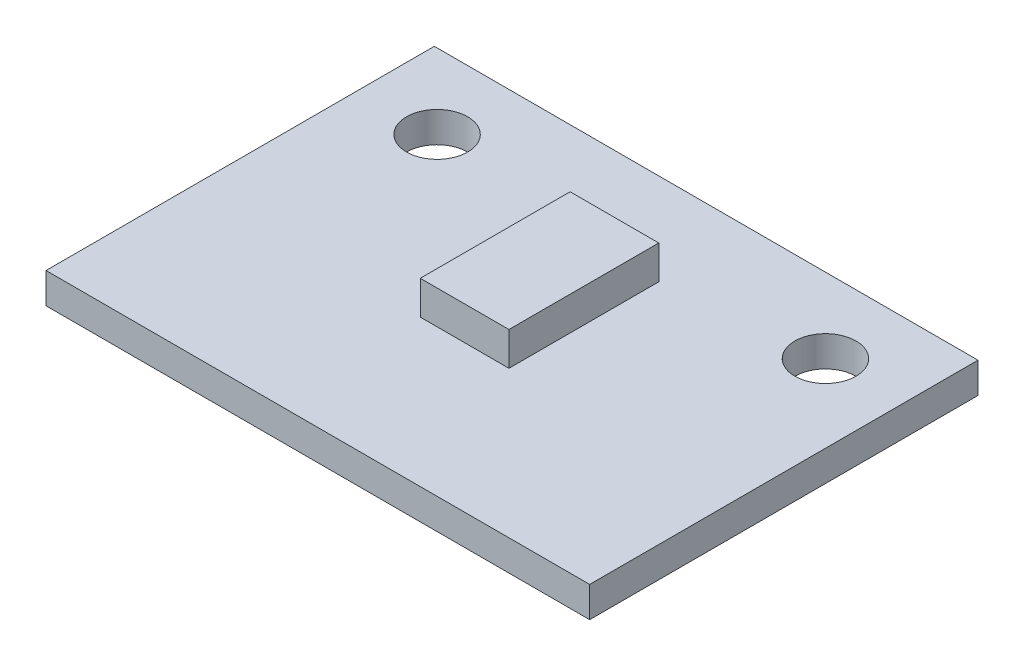
from build123d import *

# Parameters (mm, degrees)
SKETCH_1_W      = 17.78
SKETCH_1_H      = 12.7
SKETCH_1_R      = 1
SKETCH_1_W_2    = 2.9
SKETCH_1_H_2    = 4.9
EXTRUDE_1_DEPTH = 1
SKETCH_1_3_W    = 2.9
SKETCH_1_3_H    = 4.9
EXTRUDE_2_DEPTH = 2.1


with BuildPart() as part:
    # 草图1 → 凸台-拉伸1 (new body)
    # profile 1 of 2: a face of its own
    with BuildSketch(Plane(origin=(0, 0, 0), x_dir=(1, 0, 0), z_dir=(0, 1, 0))):
        Rectangle(SKETCH_1_W, SKETCH_1_H)
        with Locations(Location((6.35, 3.9, 0), (0, 0, 270))):
            Circle(SKETCH_1_R, mode=Mode.SUBTRACT)
        with Locations(Location((-6.35, 3.9, 0), (0, 0, 270))):
            Circle(SKETCH_1_R, mode=Mode.SUBTRACT)
        with Locations((0, 0.9)):
            Rectangle(SKETCH_1_W_2, SKETCH_1_H_2, mode=Mode.SUBTRACT)
    # profile 2 of 2: a face of its own
    with BuildSketch(Plane(origin=(0, 0, 0), x_dir=(1, 0, 0), z_dir=(0, 1, 0))):
        with Locations((0, 0.9)):
            Rectangle(SKETCH_1_W_2, SKETCH_1_H_2)
    extrude(amount=EXTRUDE_1_DEPTH)

    # 草图1<3> → 凸台-拉伸2 (add)
    with BuildSketch(Plane(origin=(0, 0, 0), x_dir=(1, 0, 0), z_dir=(0, 1, 0))):
        with Locations((0, 0.9)):
            Rectangle(SKETCH_1_3_W, SKETCH_1_3_H)
    extrude(amount=EXTRUDE_2_DEPTH)


solid = part.part
